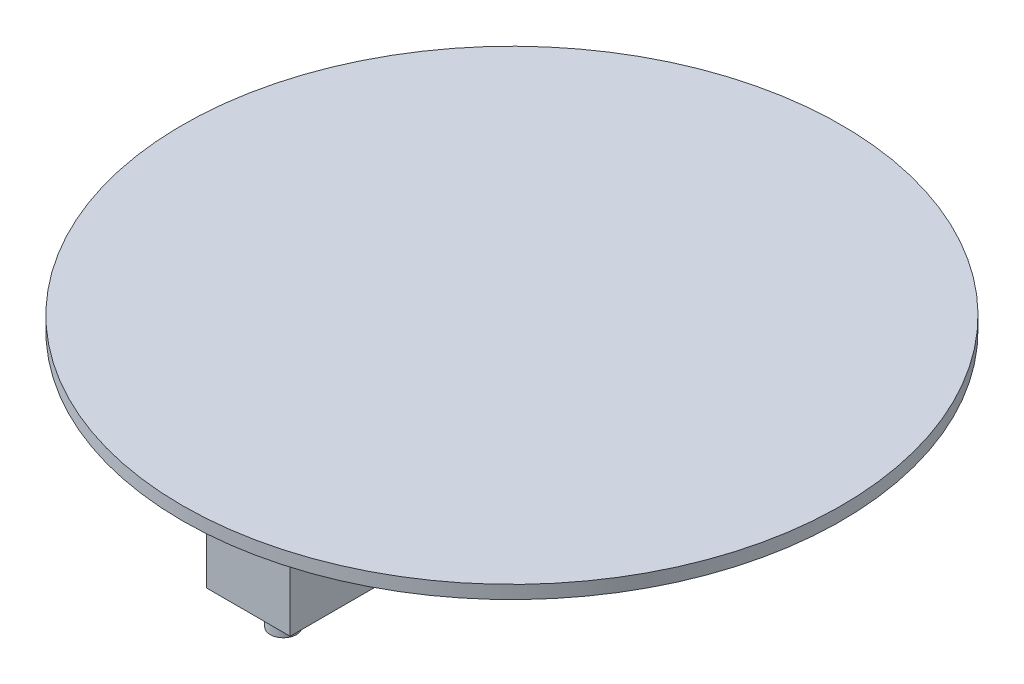
from build123d import *

# Parameters (mm, degrees)
SKETCH1_W           = 12.7
SKETCH1_H           = 12.7
BOSS_EXTRUDE1_DEPTH = 80
SKETCH2_R           = 2
CUT_EXTRUDE1_DEPTH  = 82.991341006
CUT_EXTRUDE2_DEPTH  = 82.991341006
BOSS_EXTRUDE2_START = 17
SKETCH5_R           = 2
BOSS_EXTRUDE2_DEPTH = 17
SKETCH6_R           = 2
BOSS_EXTRUDE3_DEPTH = 17
SKETCH7_R           = 50
BOSS_EXTRUDE4_DEPTH = 2


with BuildPart() as part:
    # Sketch1 → Boss-Extrude1 (new body)
    with BuildSketch(Plane.XY):
        with Locations((6.35, 6.35)):
            Rectangle(SKETCH1_W, SKETCH1_H)
    extrude(amount=BOSS_EXTRUDE1_DEPTH)

    # Sketch2 → Cut-Extrude1 (cut, through all)
    with BuildSketch(Plane(origin=(0, 12.7, 0), x_dir=(1, 0, 0), z_dir=(0, 1, 0))):
        with Locations(Location((6.668720536, -5, 0), (0, 0, 270))):
            Circle(SKETCH2_R)
        with Locations(Location((6.668720536, -20, 0), (0, 0, 270))):
            Circle(SKETCH2_R)
        with Locations(Location((6.668720536, -60, 0), (0, 0, 270))):
            Circle(SKETCH2_R)
        with Locations(Location((6.668720536, -75, 0), (0, 0, 270))):
            Circle(SKETCH2_R)
    extrude(amount=-CUT_EXTRUDE1_DEPTH, mode=Mode.SUBTRACT)

    # Sketch4 → Cut-Extrude2 (cut, through all)
    with BuildSketch(Plane.ZY):
        with BuildLine():
            ThreePointArc((40, 2.727500863), (49.05, 6.35), (40, 9.972499137))
            ThreePointArc((40, 9.972499137), (30.95, 6.35), (40, 2.727500863))
        make_face()
    extrude(amount=-CUT_EXTRUDE2_DEPTH, mode=Mode.SUBTRACT)

    # Sketch5 → Boss-Extrude2 (add)
    with BuildSketch(Plane(origin=(0, 0, 0), x_dir=(1, 0, 0), z_dir=(0, 1, 0)).offset(BOSS_EXTRUDE2_START)):
        with Locations(Location((6.668720536, -20, 0), (0, 0, 270))):
            Circle(SKETCH5_R)
        with Locations(Location((6.668720536, -5, 0), (0, 0, 270))):
            Circle(SKETCH5_R)
    extrude(amount=-BOSS_EXTRUDE2_DEPTH)

    # Sketch6 → Boss-Extrude3 (add)
    with BuildSketch(Plane(origin=(0, 12.7, 0), x_dir=(1, 0, 0), z_dir=(0, 1, 0))):
        with Locations(Location((6.668720536, -75, 0), (0, 0, 270))):
            Circle(SKETCH6_R)
        with Locations(Location((6.668720536, -60, 0), (0, 0, 270))):
            Circle(SKETCH6_R)
    extrude(amount=-BOSS_EXTRUDE3_DEPTH)

    # Sketch7 → Boss-Extrude4 (add)
    with BuildSketch(Plane(origin=(0, 17, 0), x_dir=(1, 0, 0), z_dir=(0, 1, 0))):
        with Locations(Location((6.35, -40, 0), (0, 0, 270))):
            Circle(SKETCH7_R)
    extrude(amount=BOSS_EXTRUDE4_DEPTH)


solid = part.part
